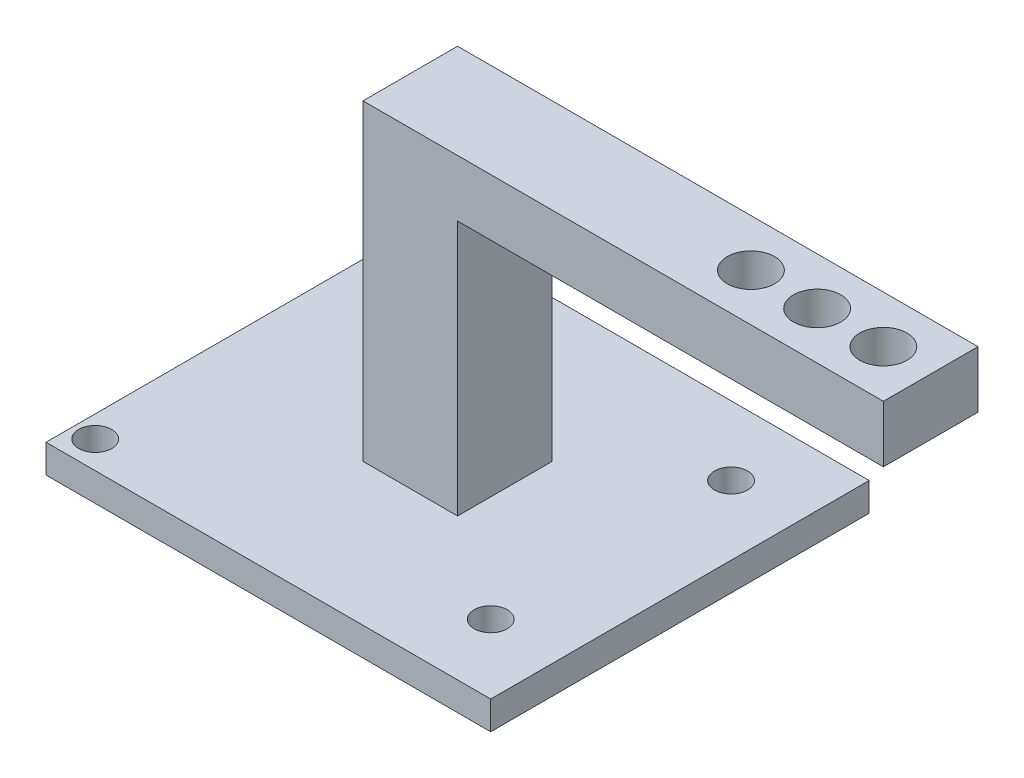
from build123d import *

# Parameters (mm, degrees)
SKETCH1_W           = 47
SKETCH1_H           = 40
SKETCH1_R           = 1.75
BOSS_EXTRUDE1_DEPTH = 3
SKETCH2_W           = 10
SKETCH2_H           = 10
BOSS_EXTRUDE3_DEPTH = 27
SKETCH3_W           = 45
SKETCH3_H           = 10
SKETCH3_W_2         = 10
BOSS_EXTRUDE4_DEPTH = 6
SKETCH4_W           = 55
SKETCH4_H           = 10
CUT_EXTRUDE1_DEPTH  = 6
SKETCH5_W           = 55
SKETCH5_H           = 10
BOSS_EXTRUDE5_DEPTH = 6
SKETCH6_R           = 2.5
CUT_EXTRUDE2_DEPTH  = 92.094730912


with BuildPart() as part:
    # Sketch1 → Boss-Extrude1 (new body)
    with BuildSketch(Plane(origin=(0, 0, 0), x_dir=(1, 0, 0), z_dir=(0, 1, 0))):
        with Locations((23.5, 20)):
            Rectangle(SKETCH1_W, SKETCH1_H)
        with Locations(Location((2.3, 2.9, 0), (0, 0, 270))):
            Circle(SKETCH1_R, mode=Mode.SUBTRACT)
        with Locations(Location((2.3, 37.1, 0), (0, 0, 270))):
            Circle(SKETCH1_R, mode=Mode.SUBTRACT)
        with Locations(Location((39.7, 32.7, 0), (0, 0, 270))):
            Circle(SKETCH1_R, mode=Mode.SUBTRACT)
        with Locations(Location((39.7, 7.3, 0), (0, 0, 270))):
            Circle(SKETCH1_R, mode=Mode.SUBTRACT)
    extrude(amount=BOSS_EXTRUDE1_DEPTH)

    # Sketch2 → Boss-Extrude3 (add)
    with BuildSketch(Plane(origin=(0, 3, 0), x_dir=(1, 0, 0), z_dir=(0, 1, 0))):
        with Locations((23.5, 20)):
            Rectangle(SKETCH2_W, SKETCH2_H)
    extrude(amount=BOSS_EXTRUDE3_DEPTH)

    # Sketch3 → Boss-Extrude4 (add)
    with BuildSketch(Plane(origin=(0, 30, 0), x_dir=(1, 0, 0), z_dir=(0, 1, 0))):
        with Locations((51, 20)):
            Rectangle(SKETCH3_W, SKETCH3_H)
        with Locations((23.5, 20)):
            Rectangle(SKETCH3_W_2, SKETCH3_H)
    extrude(amount=BOSS_EXTRUDE4_DEPTH)

    # Sketch4 → Cut-Extrude1 (cut)
    with BuildSketch(Plane(origin=(0, 36, 0), x_dir=(1, 0, 0), z_dir=(0, 1, 0))):
        with Locations((46, 20)):
            Rectangle(SKETCH4_W, SKETCH4_H)
    extrude(amount=-CUT_EXTRUDE1_DEPTH, mode=Mode.SUBTRACT)

    # Sketch5 → Boss-Extrude5 (add)
    with BuildSketch(Plane(origin=(0, 30, 0), x_dir=(1, 0, 0), z_dir=(0, 1, 0))):
        with Locations((46, 20)):
            Rectangle(SKETCH5_W, SKETCH5_H)
    extrude(amount=BOSS_EXTRUDE5_DEPTH)

    # Sketch6 → Cut-Extrude2 (cut, through all)
    with BuildSketch(Plane(origin=(0, 36, 0), x_dir=(1, 0, 0), z_dir=(0, 1, 0))):
        with Locations(Location((68.5, 20, 0), (0, 0, 270))):
            Circle(SKETCH6_R)
        with Locations(Location((61.5, 20, 0), (0, 0, 270))):
            Circle(SKETCH6_R)
        with Locations(Location((54.5, 20, 0), (0, 0, 270))):
            Circle(SKETCH6_R)
    extrude(amount=-CUT_EXTRUDE2_DEPTH, mode=Mode.SUBTRACT)


solid = part.part
